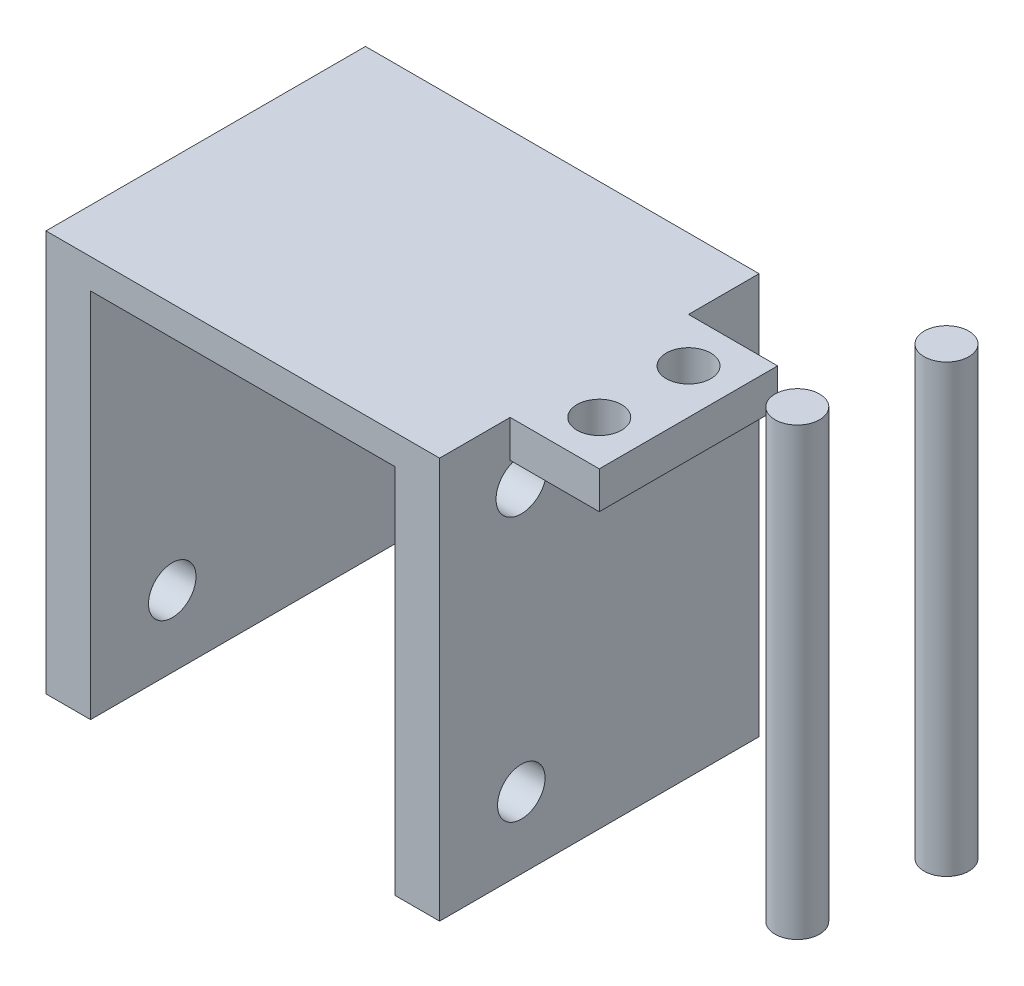
from build123d import *

# Parameters (mm, degrees)
SKETCH1_W             = 26.5
SKETCH1_H             = 27
BOSS_EXTRUDE1_DEPTH   = 36.7
SKETCH2_W             = 20.5
SKETCH2_H             = 25
CUT_EXTRUDE1_DEPTH    = 36.7
SKETCH3_R             = 1.7
SKETCH3_R_2           = 1.6
CUT_EXTRUDE2_DEPTH    = 36.7
SKETCH4_R             = 3
CUT_EXTRUDE3_DEPTH    = 36.7
SKETCH8_R             = 1.5
BOSS_EXTRUDE3_DEPTH   = 30
BOSS_EXTRUDE3_2_DEPTH = 30
SKETCH9_W             = 5.918746276
SKETCH9_H             = 6
SKETCH9_W_2           = 6.707912446
CUT_EXTRUDE4_DEPTH    = 12
SKETCH11_W            = 15.191448775
SKETCH11_H            = 37.067540439
CUT_EXTRUDE6_DEPTH    = 32
SKETCH12_W            = 12
SKETCH12_H            = 2.5
BOSS_EXTRUDE4_DEPTH   = 6
SKETCH13_R            = 1.5
CUT_EXTRUDE7_DEPTH    = 6
SKETCH14_W            = 11.732424075
SKETCH14_H            = 31.976606793
CUT_EXTRUDE8_DEPTH    = 10
SKETCH15_W            = 6
SKETCH15_H            = 12.008551225
SKETCH15_R            = 1.5
BOSS_EXTRUDE5_DEPTH   = 2.5
SKETCH16_W            = 54.936099305
SKETCH16_H            = 35.316063839
CUT_EXTRUDE9_DEPTH    = 50


with BuildPart() as part:
    # Sketch1 → Boss-Extrude1 (new body)
    with BuildSketch(Plane.XY):
        with Locations((-15.427732696, -21.46401366)):
            Rectangle(SKETCH1_W, SKETCH1_H)
    extrude(amount=BOSS_EXTRUDE1_DEPTH)

    # Sketch2 → Cut-Extrude1 (cut)
    with BuildSketch(Plane(origin=(0, 0, 0), x_dir=(-1, 0, 0), z_dir=(0, 0, -1))):
        with Locations((15.427732696, -22.46401366)):
            Rectangle(SKETCH2_W, SKETCH2_H)
    extrude(amount=-CUT_EXTRUDE1_DEPTH, mode=Mode.SUBTRACT)

    # Sketch3 → Cut-Extrude2 (cut)
    with BuildSketch(Plane(origin=(-2.177732696, 0, 0), x_dir=(0, 0, -1), z_dir=(1, 0, 0))):
        with Locations(Location((-31.2, -12.26401366, 0), (0, 0, 90))):
            Circle(SKETCH3_R)
        with Locations(Location((-31.2, -30.16401366, 0), (0, 0, 90))):
            Circle(SKETCH3_R_2)
    extrude(amount=-CUT_EXTRUDE2_DEPTH, mode=Mode.SUBTRACT)

    # Sketch4 → Cut-Extrude3 (cut)
    with BuildSketch(Plane(origin=(-2.177732696, 0, 0), x_dir=(0, 0, -1), z_dir=(1, 0, 0))):
        with Locations(Location((-12.025092395, -21.16401366, 0), (0, 0, 90))):
            Circle(SKETCH4_R)
    extrude(amount=-CUT_EXTRUDE3_DEPTH, mode=Mode.SUBTRACT)

    # Sketch9 → Cut-Extrude4 (cut)
    with BuildSketch(Plane(origin=(0, 0, 0), x_dir=(-1, 0, 0), z_dir=(0, 0, -1))):
        with Locations((3.689038825, -21.16401366)):
            Rectangle(SKETCH9_W, SKETCH9_H)
        with Locations((28.103867214, -21.16401366)):
            Rectangle(SKETCH9_W_2, SKETCH9_H)
    extrude(amount=-CUT_EXTRUDE4_DEPTH, mode=Mode.SUBTRACT)

    # Sketch11 → Cut-Extrude6 (cut)
    with BuildSketch(Plane.ZY.offset(28.677732696)):
        with Locations((7.595724388, -16.43024344)):
            Rectangle(SKETCH11_W, SKETCH11_H)
    extrude(amount=-CUT_EXTRUDE6_DEPTH, mode=Mode.SUBTRACT)

    # Sketch12 → Boss-Extrude4 (add)
    with BuildSketch(Plane.ZY.offset(28.677732696)):
        with Locations((25.95, -9.21401366)):
            Rectangle(SKETCH12_W, SKETCH12_H)
    extrude(amount=BOSS_EXTRUDE4_DEPTH)

    # Sketch13 → Cut-Extrude7 (cut)
    with BuildSketch(Plane(origin=(0, -7.96401366, 0), x_dir=(1, 0, 0), z_dir=(0, 1, 0))):
        with Locations(Location((-31.677732696, -22.95, 0), (0, 0, 180))):
            Circle(SKETCH13_R)
        with Locations(Location((-31.677732696, -28.95, 0), (0, 0, 180))):
            Circle(SKETCH13_R)
    extrude(amount=-CUT_EXTRUDE7_DEPTH, mode=Mode.SUBTRACT)


with BuildPart() as body_2:
    # Sketch8 → Boss-Extrude3 (new body)
    with BuildSketch(Plane(origin=(0, -7.96401366, 0), x_dir=(1, 0, 0), z_dir=(0, 1, 0))):
        with Locations(Location((7.15742756, -12.973989901, 0), (0, 0, 180))):
            Circle(SKETCH8_R)
    extrude(amount=-BOSS_EXTRUDE3_DEPTH)


with BuildPart() as body_3:
    # Sketch8 → Boss-Extrude3 2 (new body)
    with BuildSketch(Plane(origin=(0, -7.96401366, 0), x_dir=(1, 0, 0), z_dir=(0, 1, 0))):
        with Locations(Location((7.574350551, -21.669812293, 0), (0, 0, 180))):
            Circle(SKETCH8_R)
    extrude(amount=-BOSS_EXTRUDE3_2_DEPTH)


with BuildPart() as body_4:
    # Body-Move/Copy4: copy of part
    add(part.part.moved(Location((-70.821628829, 0, 0))))

    # Sketch14 → Cut-Extrude8 (cut)
    with BuildSketch(Plane(origin=(0, -7.96401366, 0), x_dir=(1, 0, 0), z_dir=(0, 1, 0))):
        with Locations((-105.365573562, -18.867606945)):
            Rectangle(SKETCH14_W, SKETCH14_H)
    extrude(amount=-CUT_EXTRUDE8_DEPTH, mode=Mode.SUBTRACT)

    # Sketch15 → Boss-Extrude5 (add)
    with BuildSketch(Plane(origin=(0, -7.96401366, 0), x_dir=(1, 0, 0), z_dir=(0, 1, 0))):
        with Locations((-69.999361524, -25.945724388)):
            Rectangle(SKETCH15_W, SKETCH15_H)
        with Locations(Location((-69.999361524, -22.941448775, 0), (0, 0, 180))):
            Circle(SKETCH15_R, mode=Mode.SUBTRACT)
        with Locations(Location((-69.999361524, -28.95, 0), (0, 0, 180))):
            Circle(SKETCH15_R, mode=Mode.SUBTRACT)
    extrude(amount=-BOSS_EXTRUDE5_DEPTH)


with BuildPart() as body_5:
    # Body-Move/Copy5: copy of body 2
    add(body_2.part.moved(Location((-69.754488263, 0, 0))))


with BuildPart() as body_6:
    # Body-Move/Copy6: copy of body 3
    add(body_3.part.moved(Location((-71.521118541, 0, 0))))


with BuildPart() as cut_extrude9_tool:
    # Sketch16 → Cut-Extrude9 (new body)
    with BuildSketch(Plane(origin=(0, -7.96401366, 0), x_dir=(1, 0, 0), z_dir=(0, 1, 0))):
        with Locations((-11.531444604, -23.623773167)):
            Rectangle(SKETCH16_W, SKETCH16_H)
    extrude(amount=-CUT_EXTRUDE9_DEPTH)


with BuildPart() as part_1:
    add(part.part)

    # Cut-Extrude9: cut by cut_extrude9_tool
    add(cut_extrude9_tool.part, mode=Mode.SUBTRACT)


with BuildPart() as body_2_1:
    add(body_2.part)

    # Cut-Extrude9: cut by cut_extrude9_tool
    add(cut_extrude9_tool.part, mode=Mode.SUBTRACT)


with BuildPart() as body_3_1:
    add(body_3.part)

    # Cut-Extrude9: cut by cut_extrude9_tool
    add(cut_extrude9_tool.part, mode=Mode.SUBTRACT)


solid = Compound([body_4.part, body_5.part, body_6.part])
